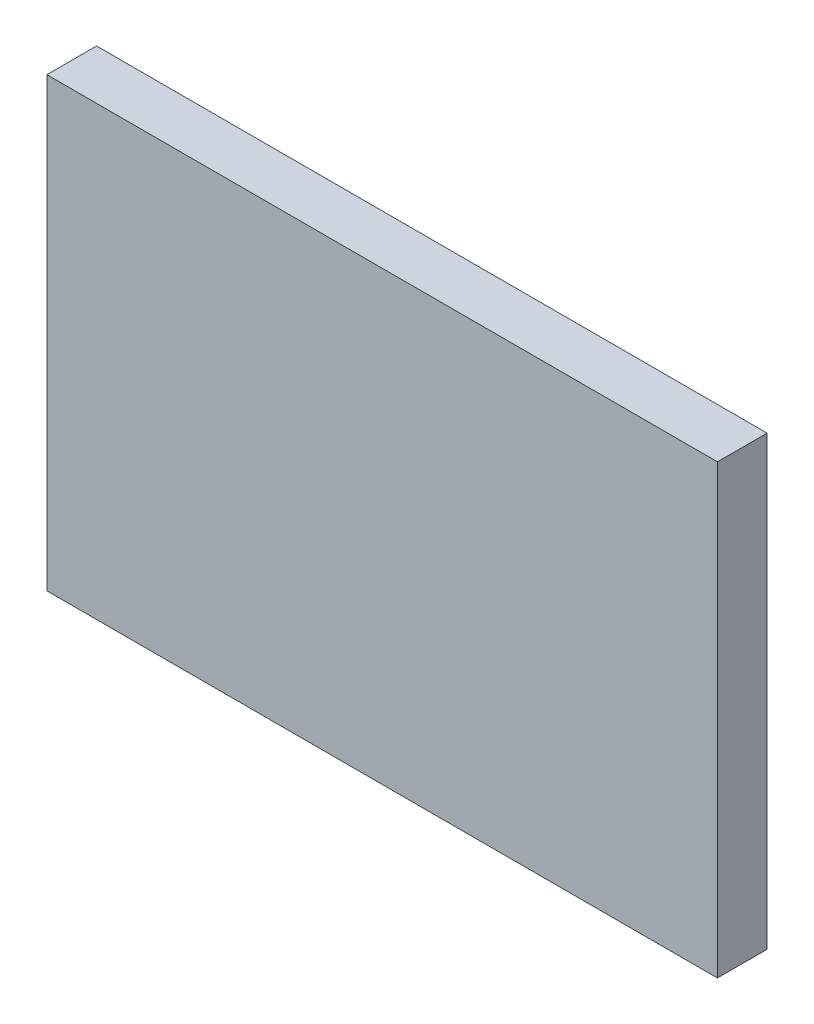
from build123d import *

# Parameters (mm, degrees)
SKETCH1_W  = 101.6
SKETCH1_H  = 914.4
BASE_DEPTH = 1371.6


with BuildPart() as part:
    # Sketch1 → Base (new body)
    with BuildSketch(Plane(origin=(0, 0, 0), x_dir=(0, 0, -1), z_dir=(1, 0, 0))):
        with Locations((50.8, 457.2)):
            Rectangle(SKETCH1_W, SKETCH1_H)
    extrude(amount=BASE_DEPTH)


solid = part.part
